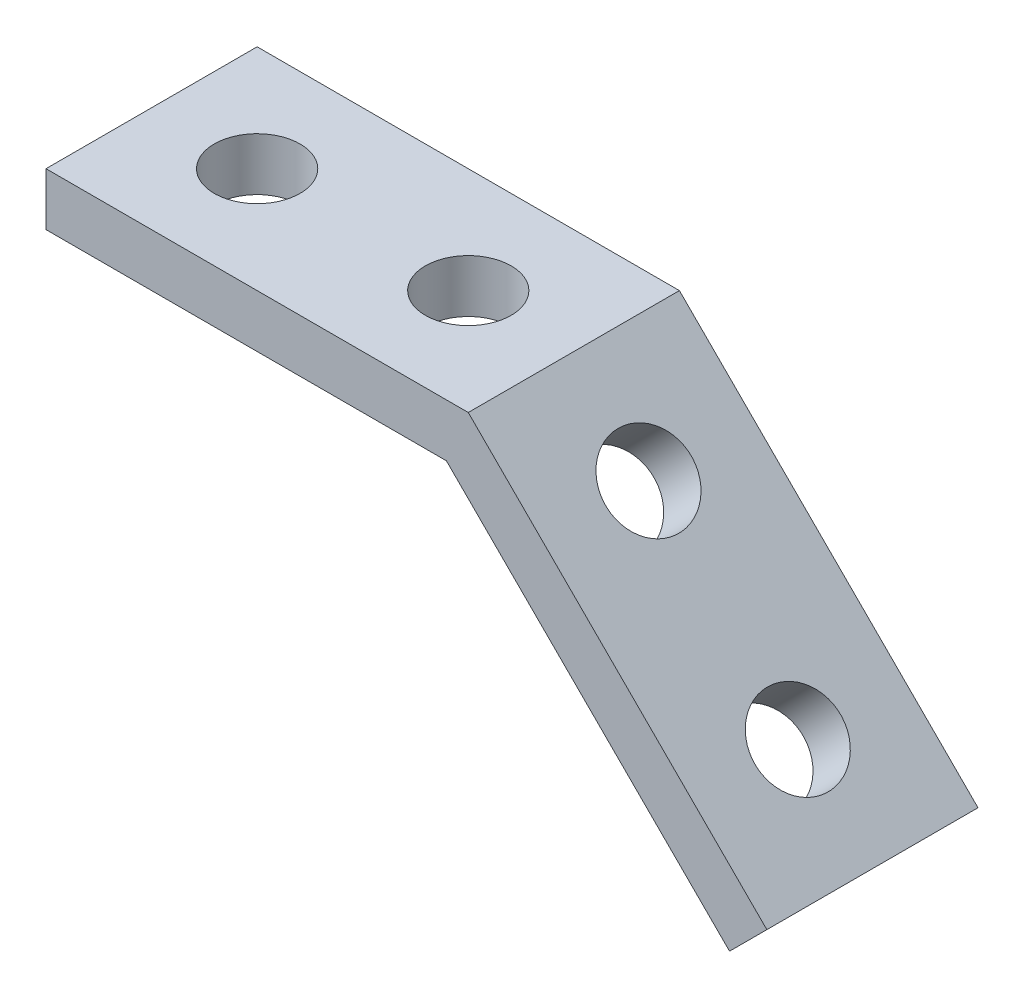
from build123d import *

# Parameters (mm, degrees)
BOSS_EXTRUDE1_DEPTH = 12.7
SKETCH2_R           = 2.5796875
CUT_EXTRUDE1_DEPTH  = 12.7
SKETCH3_R           = 2.5796875
CUT_EXTRUDE2_DEPTH  = 12.7


with BuildPart() as part:
    # Sketch1 → Boss-Extrude1 (new body)
    with BuildSketch(Plane.XY):
        Polygon((-102.370082778, 43.999509732), (-76.970082778, 43.999509732), (-59.009570536, 26.03899749), (-61.254634567, 23.79393346), (-78.285210839, 40.824509732), (-102.370082778, 40.824509732), align=None)
    extrude(amount=BOSS_EXTRUDE1_DEPTH)

    # Sketch2 → Cut-Extrude1 (cut)
    with BuildSketch(Plane(origin=(0, 43.999509732, 0), x_dir=(1, 0, 0), z_dir=(0, 1, 0))):
        with Locations(Location((-96.020082778, -6.35, 0), (0, 0, 180))):
            Circle(SKETCH2_R)
        with Locations(Location((-83.320082778, -6.35, 0), (0, 0, 180))):
            Circle(SKETCH2_R)
    extrude(amount=-CUT_EXTRUDE1_DEPTH, mode=Mode.SUBTRACT)

    # Sketch3 → Cut-Extrude2 (cut)
    with BuildSketch(Plane(origin=(-16.485286523, -16.485286523, 0), x_dir=(0, 0, -1), z_dir=(0.707106781186552, 0.707106781186543, 0))):
        with Locations(Location((-6.35, 66.488419182, 0), (0, 0, 90))):
            Circle(SKETCH3_R)
        with Locations(Location((-6.35, 79.188419182, 0), (0, 0, 90))):
            Circle(SKETCH3_R)
    extrude(amount=-CUT_EXTRUDE2_DEPTH, mode=Mode.SUBTRACT)


solid = part.part
